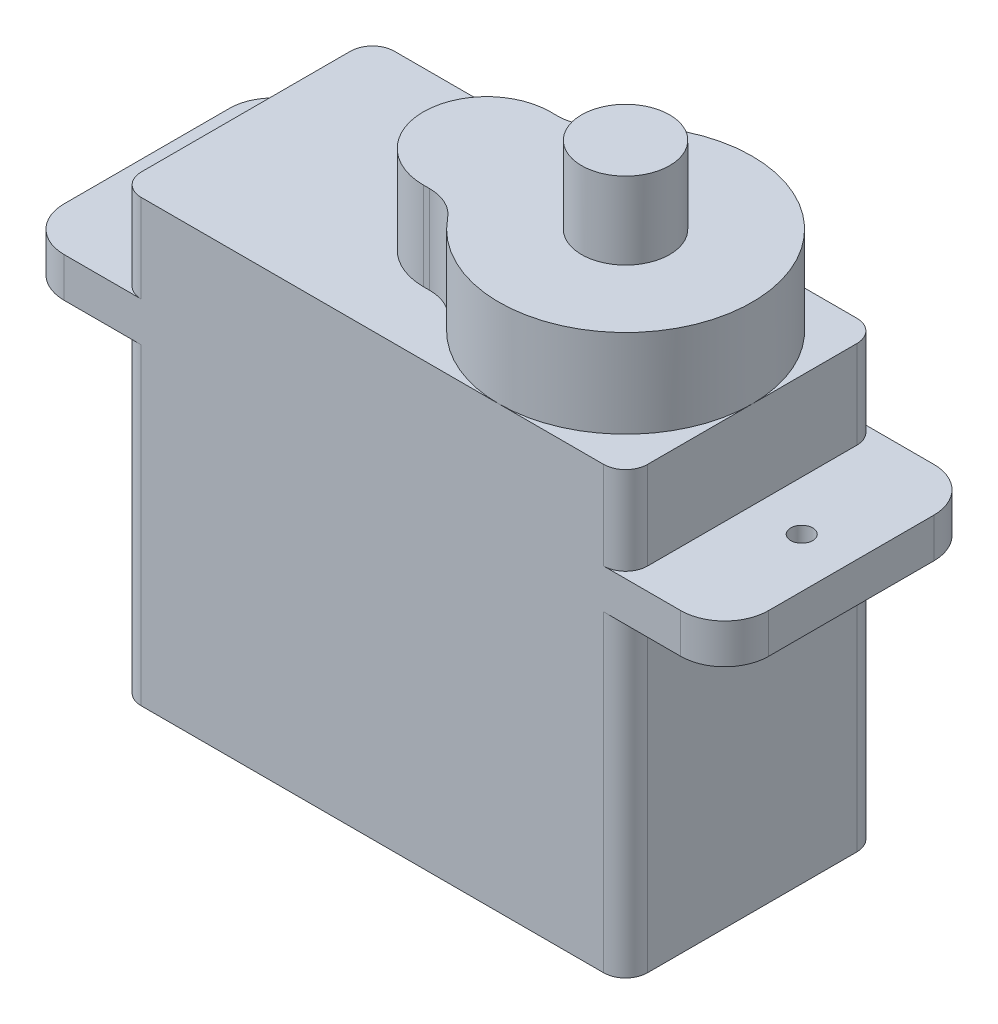
from build123d import *
from OCP.BRepFilletAPI import BRepFilletAPI_MakeFillet

# Parameters (mm, degrees)
ESQUISSE1_W             = 23
ESQUISSE1_H             = 20
BOSS_EXTRU_1_DEPTH      = 11.5
ESQUISSE2_W             = 11.5
ESQUISSE2_H             = 1.8
BOSS_EXTRU_2_DEPTH      = 4.5
BOSS_EXTRU_3_DEPTH      = 4
ENL_V_MAT_EXTRU_1_REACH = 27.382
ESQUISSE4_R             = 0.5
CONG_1_R1               = 1
CONG_1_R2               = 2
ESQUISSE5_R             = 2
BOSS_EXTRU_4_DEPTH      = 3.5


with BuildPart() as part:
    # Esquisse1 → Boss.-Extru.1 (new body)
    with BuildSketch(Plane.XY):
        Rectangle(ESQUISSE1_W, ESQUISSE1_H)
    extrude(amount=BOSS_EXTRU_1_DEPTH)

    # Esquisse2 → Boss.-Extru.2 (add)
    with BuildSketch(Plane(origin=(11.5, 0, 0), x_dir=(0, 0, -1), z_dir=(1, 0, 0))):
        with Locations((-5.75, 5.1)):
            Rectangle(ESQUISSE2_W, ESQUISSE2_H)
    boss_extru_2 = extrude(amount=BOSS_EXTRU_2_DEPTH)

    # Symétrie1: Boss.-Extru.2 across plane
    add(boss_extru_2.mirror(Plane(origin=(0, 0, 0), x_dir=(0, 0, 1), z_dir=(1, 0, 0))))

    # Esquisse3 → Boss.-Extru.3 (add)
    with BuildSketch(Plane(origin=(0, 10, 0), x_dir=(1, 0, 0), z_dir=(0, 1, 0))):
        with BuildLine():
            Line((-0.290992678, -8.604781917), (-0.577609195, -8.604781917))
            ThreePointArc((-0.577609195, -8.604781917), (-3.459311015, -5.723080096), (-0.577609195, -2.841378276))
            Line((-0.577609195, -2.841378276), (-0.247327135, -2.841378276))
            ThreePointArc((-0.247327135, -2.841378276), (0.608978248, -2.648791092), (1.30037019, -2.108119366))
            ThreePointArc((1.30037019, -2.108119366), (11.499942495, -5.775715864), (1.267973174, -9.351934971))
            ThreePointArc((1.267973174, -9.351934971), (0.573387477, -8.801216851), (-0.290992678, -8.604781917))
        make_face()
    extrude(amount=BOSS_EXTRU_3_DEPTH)

    # Esquisse4 → Enlèv. mat.-Extru.1 (cut, up to next)
    with BuildSketch(Plane(origin=(0, 6, 0), x_dir=(1, 0, 0), z_dir=(0, 1, 0)), mode=Mode.PRIVATE) as enl_v_mat_extru_1_sk1:
        with Locations((-13.75, -5.75)):
            Circle(ESQUISSE4_R)
    enl_v_mat_extru_1_tool1 = extrude(enl_v_mat_extru_1_sk1.sketch, amount=-ENL_V_MAT_EXTRU_1_REACH, mode=Mode.PRIVATE) & part.part
    enl_v_mat_extru_1 = enl_v_mat_extru_1_tool1.solids().sort_by_distance((-13.75, 6, 5.75))[0]
    add(enl_v_mat_extru_1, mode=Mode.SUBTRACT)

    # Symétrie2: Enlèv. mat.-Extru.1 across plane
    add(enl_v_mat_extru_1.mirror(Plane(origin=(0, 0, 0), x_dir=(0, 0, 1), z_dir=(1, 0, 0))), mode=Mode.SUBTRACT)

    # Congé1: one fillet with a radius per group of edges: ONE call of the kernel's fillet builder (fillet() takes one radius for all edges)
    cong_1_edges_1 = [part.edges().sort_by_distance(p)[0] for p in [
        (-11.5, -2.9, 11.5),
        (-11.5, -2.9, 0),
        (-11.5, 8, 0),
        (-11.5, 8, 11.5),
        (11.5, 8, 11.5),
        (11.5, 8, 0),
        (11.5, -2.9, 11.5),
        (11.5, -2.9, 0),
    ]]
    cong_1_edges_2 = [part.edges().sort_by_distance(p)[0] for p in [
        (-16, 5.1, 11.5),
        (-16, 5.1, 0),
        (16, 5.1, 0),
        (16, 5.1, 11.5),
    ]]
    cong_1 = BRepFilletAPI_MakeFillet(part.part.solid().wrapped)
    for e in cong_1_edges_1:
        cong_1.Add(CONG_1_R1, e.wrapped)
    for e in cong_1_edges_2:
        cong_1.Add(CONG_1_R2, e.wrapped)
    add(Compound.cast(cong_1.Shape()), mode=Mode.REPLACE)

    # Esquisse5 → Boss.-Extru.4 (add)
    with BuildSketch(Plane(origin=(0, 14, 0), x_dir=(1, 0, 0), z_dir=(0, 1, 0))):
        with Locations((5.75, -5.75)):
            Circle(ESQUISSE5_R)
    extrude(amount=BOSS_EXTRU_4_DEPTH)


solid = part.part
